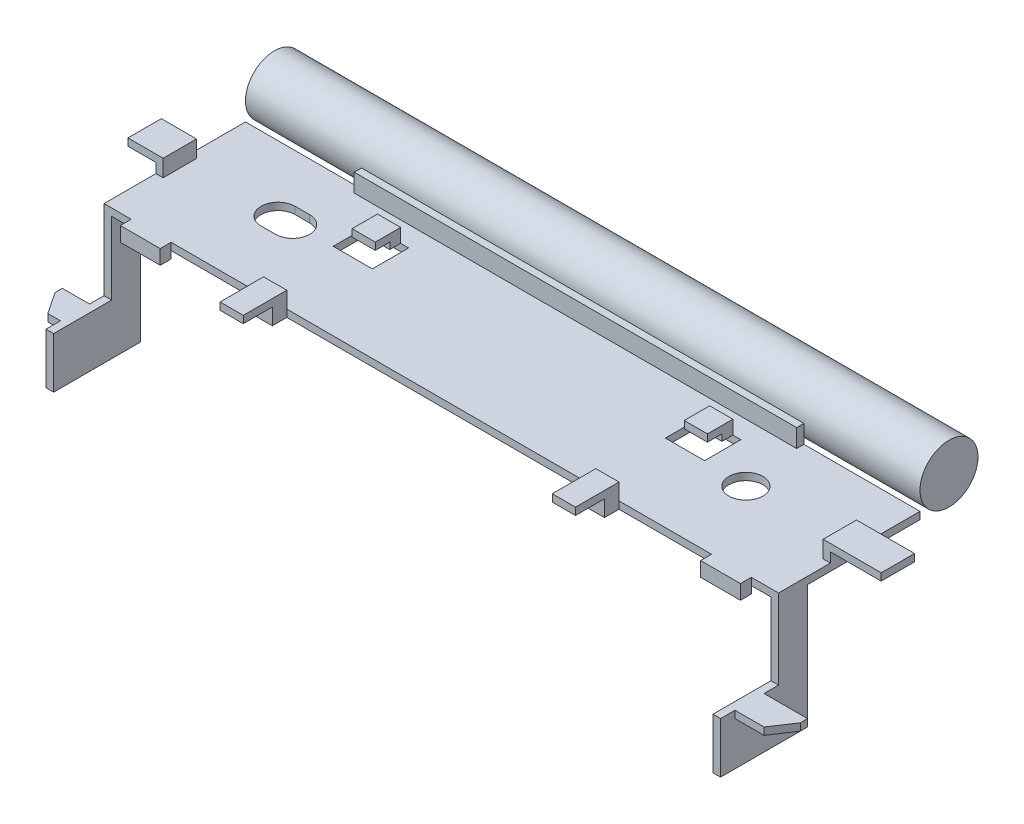
from build123d import *

# Parameters (mm, degrees)
SKETCH_1_W             = 93
SKETCH_1_H             = 19.5
EXTRUDE_1_DEPTH        = 1
SKETCH_2_W             = 61
SKETCH_2_H             = 1
EXTRUDE_2_DEPTH        = 2.5
EXTRUDE_3_DEPTH        = 2.25
EXTRUDE_3_DEPTH_BACK   = 1
SKETCH_3_W             = 3.2
SKETCH_3_H             = 2
EXTRUDE_3_2_DEPTH      = 2.25
EXTRUDE_3_2_DEPTH_BACK = 1
SKETCH_4_W             = 3.2
SKETCH_4_H             = 1
EXTRUDE_4_DEPTH        = 4
SKETCH_5_W             = 5.4
SKETCH_5_H             = 5
CUT_EXTRUDE_1_DEPTH    = 5
SKETCH_6_W             = 3.2
SKETCH_6_H             = 1.5
EXTRUDE_5_DEPTH        = 1.9
EXTRUDE_5_2_DEPTH      = 1.9
SKETCH_7_W             = 3.2
SKETCH_7_H             = 1
EXTRUDE_6_DEPTH        = 2
SKETCH_8_R             = 2.35
CUT_EXTRUDE_2_DEPTH    = 96.055247093
SKETCH_9_R             = 4
EXTRUDE_7_DEPTH        = 93
SKETCH_10_W            = 1
SKETCH_10_H            = 4.6
EXTRUDE_8_DEPTH        = 2.34
SKETCH_11_W            = 7
SKETCH_11_H            = 4.6
SKETCH_11_W_2          = 3.85
EXTRUDE_9_DEPTH        = 1
SKETCH_12_W            = 1.05
SKETCH_12_H            = 17
EXTRUDE_10_DEPTH       = 4
EXTRUDE_11_DEPTH       = 1
EXTRUDE_11_DEPTH_BACK  = 1
SKETCH_13_W            = 5.5
SKETCH_13_H            = 1.5
SKETCH_14_W            = 8
SKETCH_14_H            = 7
EXTRUDE_12_DEPTH       = 1.05
SKETCH_15_W            = 4
SKETCH_15_H            = 1
EXTRUDE_13_DEPTH       = 6
CUT_EXTRUDE_3_DEPTH    = 6
SKETCH_17_W            = 8
SKETCH_17_H            = 7
EXTRUDE_14_DEPTH       = 1.05
SKETCH_18_W            = 4
SKETCH_18_H            = 1
EXTRUDE_15_DEPTH       = 3.75
CUT_EXTRUDE_4_DEPTH    = 3.75


with BuildPart() as part:
    # 草图1 → 凸台-拉伸1 (new body)
    with BuildSketch(Plane(origin=(0, 0, 0), x_dir=(1, 0, 0), z_dir=(0, 1, 0))):
        with Locations((46.5, 9.75)):
            Rectangle(SKETCH_1_W, SKETCH_1_H)
    extrude(amount=EXTRUDE_1_DEPTH)

    # 草图2 → 凸台-拉伸2 (add)
    with BuildSketch(Plane(origin=(0, 1, 0), x_dir=(1, 0, 0), z_dir=(0, 1, 0))):
        with Locations((46.5, 19)):
            Rectangle(SKETCH_2_W, SKETCH_2_H)
    extrude(amount=EXTRUDE_2_DEPTH)

    # 草图5 → 切除-拉伸1 (cut)
    with BuildSketch(Plane(origin=(0, 1, 0), x_dir=(1, 0, 0), z_dir=(0, 1, 0))):
        with Locations((23.6, 13.2)):
            Rectangle(SKETCH_5_W, SKETCH_5_H)
        with Locations((69.4, 13.2)):
            Rectangle(SKETCH_5_W, SKETCH_5_H)
    extrude(amount=-CUT_EXTRUDE_1_DEPTH, mode=Mode.SUBTRACT)

    # 草图8 → 切除-拉伸2 (cut, through all)
    with BuildSketch(Plane(origin=(0, 1, 0), x_dir=(1, 0, 0), z_dir=(0, 1, 0))):
        with Locations(Location((78, 10.5, 0), (0, 0, 270))):
            Circle(SKETCH_8_R)
        with BuildLine():
            Line((13.5, 12.85), (15.5, 12.85))
            ThreePointArc((15.5, 12.85), (17.85, 10.5), (15.5, 8.15))
            Line((15.5, 8.15), (13.5, 8.15))
            ThreePointArc((13.5, 8.15), (11.15, 10.5), (13.5, 12.85))
        make_face()
    extrude(amount=-CUT_EXTRUDE_2_DEPTH, mode=Mode.SUBTRACT)

    # 草图10 → 凸台-拉伸8 (add)
    with BuildSketch(Plane(origin=(0, 1, 0), x_dir=(1, 0, 0), z_dir=(0, 1, 0))):
        with Locations((92.5, 9.45)):
            Rectangle(SKETCH_10_W, SKETCH_10_H)
        with Locations((0.5, 9.45)):
            Rectangle(SKETCH_10_W, SKETCH_10_H)
    extrude(amount=EXTRUDE_8_DEPTH)

    # 草图11 → 凸台-拉伸9 (add)
    with BuildSketch(Plane(origin=(0, 3.34, 0), x_dir=(1, 0, 0), z_dir=(0, 1, 0))):
        with Locations((96.5, 9.45)):
            Rectangle(SKETCH_11_W, SKETCH_11_H)
        with Locations((-1.925, 9.45)):
            Rectangle(SKETCH_11_W_2, SKETCH_11_H)
    extrude(amount=-EXTRUDE_9_DEPTH)

    # 草图12 → 凸台-拉伸10 (add)
    with BuildSketch(Plane.XY):
        with Locations((92.475, -8.5)):
            Rectangle(SKETCH_12_W, SKETCH_12_H)
        with Locations((0.525, -8.5)):
            Rectangle(SKETCH_12_W, SKETCH_12_H)
    extrude(amount=-EXTRUDE_10_DEPTH)

    # 草图13 → 凸台-拉伸11 (add, two sides: drawn at the far end of the back side and taken through both)
    with BuildSketch(Plane.XZ.offset(-EXTRUDE_11_DEPTH_BACK)):
        with Locations((6.5, 0.75)):
            Rectangle(SKETCH_13_W, SKETCH_13_H)
        with Locations((86.5, 0.75)):
            Rectangle(SKETCH_13_W, SKETCH_13_H)
    extrude(amount=EXTRUDE_11_DEPTH + EXTRUDE_11_DEPTH_BACK)

    # 草图14 → 凸台-拉伸12 (add)
    with BuildSketch(Plane(origin=(93, 0, 0), x_dir=(0, 0, -1), z_dir=(1, 0, 0))):
        with Locations((-4, -13.5)):
            Rectangle(SKETCH_14_W, SKETCH_14_H)
    extrude(amount=-EXTRUDE_12_DEPTH)

    # 草图15 → 凸台-拉伸13 (add)
    with BuildSketch(Plane(origin=(93, 0, 0), x_dir=(0, 0, -1), z_dir=(1, 0, 0))):
        with Locations((-4, -10.5)):
            Rectangle(SKETCH_15_W, SKETCH_15_H)
    extrude(amount=EXTRUDE_13_DEPTH)

    # 草图16 → 切除-拉伸3 (cut)
    with BuildSketch(Plane(origin=(0, -10, 0), x_dir=(1, 0, 0), z_dir=(0, 1, 0))):
        Polygon((99, -3), (97, -6), (99, -6), align=None)
    extrude(amount=-CUT_EXTRUDE_3_DEPTH, mode=Mode.SUBTRACT)

    # 草图17 → 凸台-拉伸14 (add)
    with BuildSketch(Plane.ZY):
        with Locations((4, -13.5)):
            Rectangle(SKETCH_17_W, SKETCH_17_H)
    extrude(amount=-EXTRUDE_14_DEPTH)

    # 草图18 → 凸台-拉伸15 (add)
    with BuildSketch(Plane.ZY):
        with Locations((4, -10.5)):
            Rectangle(SKETCH_18_W, SKETCH_18_H)
    extrude(amount=EXTRUDE_15_DEPTH)

    # 草图19 → 切除-拉伸4 (cut)
    with BuildSketch(Plane(origin=(0, -10, 0), x_dir=(1, 0, 0), z_dir=(0, 1, 0))):
        Polygon((-3.75, -3), (-1.75, -6), (-3.75, -6), align=None)
    extrude(amount=-CUT_EXTRUDE_4_DEPTH, mode=Mode.SUBTRACT)


with BuildPart() as body_2:
    # 草图3 → 凸台-拉伸3 (new, two sides: drawn at the far end of the back side and taken through both)
    with BuildSketch(Plane(origin=(0, 1, 0), x_dir=(1, 0, 0), z_dir=(0, 1, 0)).offset(-EXTRUDE_3_DEPTH_BACK)):
        with Locations((69.4, -1)):
            Rectangle(SKETCH_3_W, SKETCH_3_H)
    extrude(amount=EXTRUDE_3_DEPTH + EXTRUDE_3_DEPTH_BACK)



with BuildPart() as body_3:
    # 草图3 → Extrude 3 2 (new, two sides: drawn at the far end of the back side and taken through both)
    with BuildSketch(Plane(origin=(0, 1, 0), x_dir=(1, 0, 0), z_dir=(0, 1, 0)).offset(-EXTRUDE_3_2_DEPTH_BACK)):
        with Locations((23.6, -1)):
            Rectangle(SKETCH_3_W, SKETCH_3_H)
    extrude(amount=EXTRUDE_3_2_DEPTH + EXTRUDE_3_2_DEPTH_BACK)


with BuildPart() as body_2_1:
    add(body_2.part)

    add(body_3.part)  # 凸台-拉伸4 merges body 3
    # 草图4 → 凸台-拉伸4 (add)
    with BuildSketch(Plane.XY.offset(2)):
        with Locations((23.6, 2.75)):
            Rectangle(SKETCH_4_W, SKETCH_4_H)
        with Locations((69.4, 2.75)):
            Rectangle(SKETCH_4_W, SKETCH_4_H)
    extrude(amount=EXTRUDE_4_DEPTH)


with BuildPart() as body_3_2:
    # 草图6 → 凸台-拉伸5 (new body)
    with BuildSketch(Plane(origin=(0, 1, 0), x_dir=(1, 0, 0), z_dir=(0, 1, 0))):
        with Locations((23.6, 14.95)):
            Rectangle(SKETCH_6_W, SKETCH_6_H)
    extrude(amount=EXTRUDE_5_DEPTH)



with BuildPart() as body_4:
    # 草图6 → Extrude 5 2 (new body)
    with BuildSketch(Plane(origin=(0, 1, 0), x_dir=(1, 0, 0), z_dir=(0, 1, 0))):
        with Locations((69.4, 14.95)):
            Rectangle(SKETCH_6_W, SKETCH_6_H)
    extrude(amount=EXTRUDE_5_2_DEPTH)


with BuildPart() as body_3_2_1:
    add(body_3_2.part)

    add(body_4.part)  # 凸台-拉伸6 merges body 4
    # 草图7 → 凸台-拉伸6 (add)
    with BuildSketch(Plane.XY.offset(-14.2)):
        with Locations((23.6, 2.4)):
            Rectangle(SKETCH_7_W, SKETCH_7_H)
        with Locations((69.4, 2.4)):
            Rectangle(SKETCH_7_W, SKETCH_7_H)
    extrude(amount=EXTRUDE_6_DEPTH)


with BuildPart() as body_4_2:
    # 草图9 → 凸台-拉伸7 (new body)
    with BuildSketch(Plane(origin=(93, 0, 0), x_dir=(0, 0, -1), z_dir=(1, 0, 0))):
        with Locations((23.5, 3.5)):
            Circle(SKETCH_9_R)
    extrude(amount=-EXTRUDE_7_DEPTH)


solid = Compound([part.part, body_2_1.part, body_3_2_1.part, body_4_2.part])
